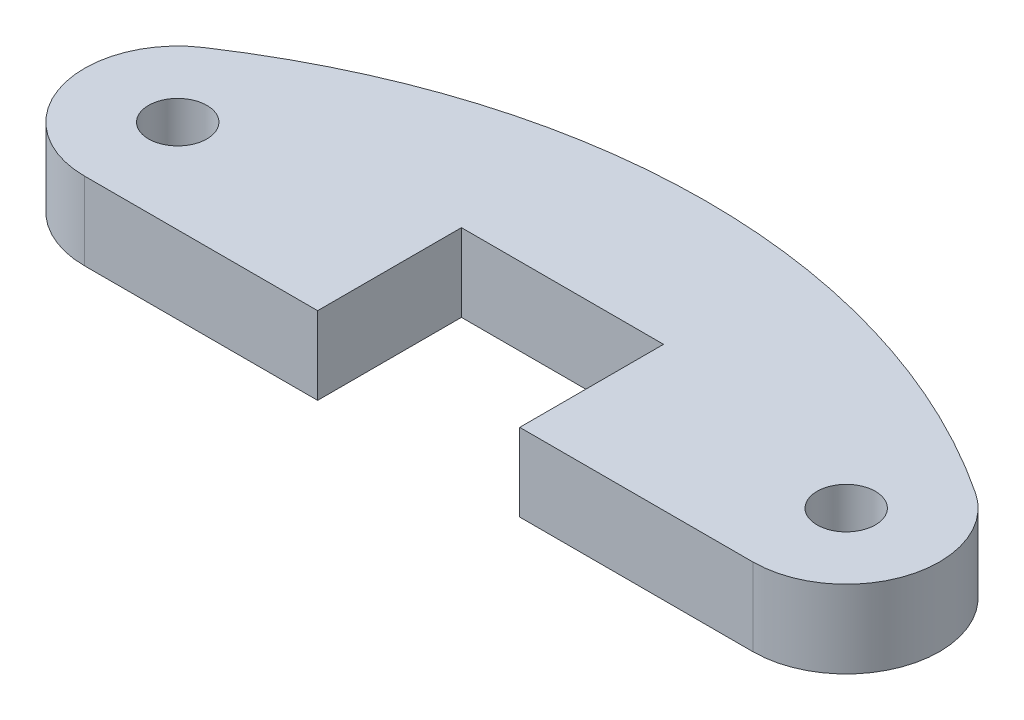
from build123d import *

# Parameters (mm, degrees)
SKETCH1_R           = 1.875
BOSS_EXTRUDE1_DEPTH = 5


with BuildPart() as part:
    # Sketch1 → Boss-Extrude1 (new body)
    with BuildSketch(Plane(origin=(0, 0, 0), x_dir=(1, 0, 0), z_dir=(0, 1, 0))):
        with BuildLine():
            Line((21.5, -6), (6.5, -6))
            Line((6.5, -6), (6.5, -3.25))
            Line((6.5, -3.25), (6.5, 3.25))
            Line((6.5, 3.25), (-6.5, 3.25))
            Line((-6.5, 3.25), (-6.5, -3.25))
            Line((-6.5, -3.25), (-6.5, -6))
            Line((-6.5, -6), (-21.5, -6))
            ThreePointArc((-21.5, -6), (-27.244562647, -1.732050808), (-24.81662479, 5))
            add(Edge.make_bspline(
                [(-24.81662479, 5), (-8.736295123, 15.666484002), (10.378585258, 14.577111967), (24.81662479, 5)],
                knots=[0, 0, 0, 0, 1, 1, 1, 1], degree=3))
            ThreePointArc((24.81662479, 5), (27.244562647, -1.732050808), (21.5, -6))
        make_face()
        with Locations(Location((-21.5, 0, 0), (0, 0, 270))):
            Circle(SKETCH1_R, mode=Mode.SUBTRACT)
        with Locations(Location((21.5, 0, 0), (0, 0, 90))):
            Circle(SKETCH1_R, mode=Mode.SUBTRACT)
    extrude(amount=BOSS_EXTRUDE1_DEPTH)


solid = part.part
